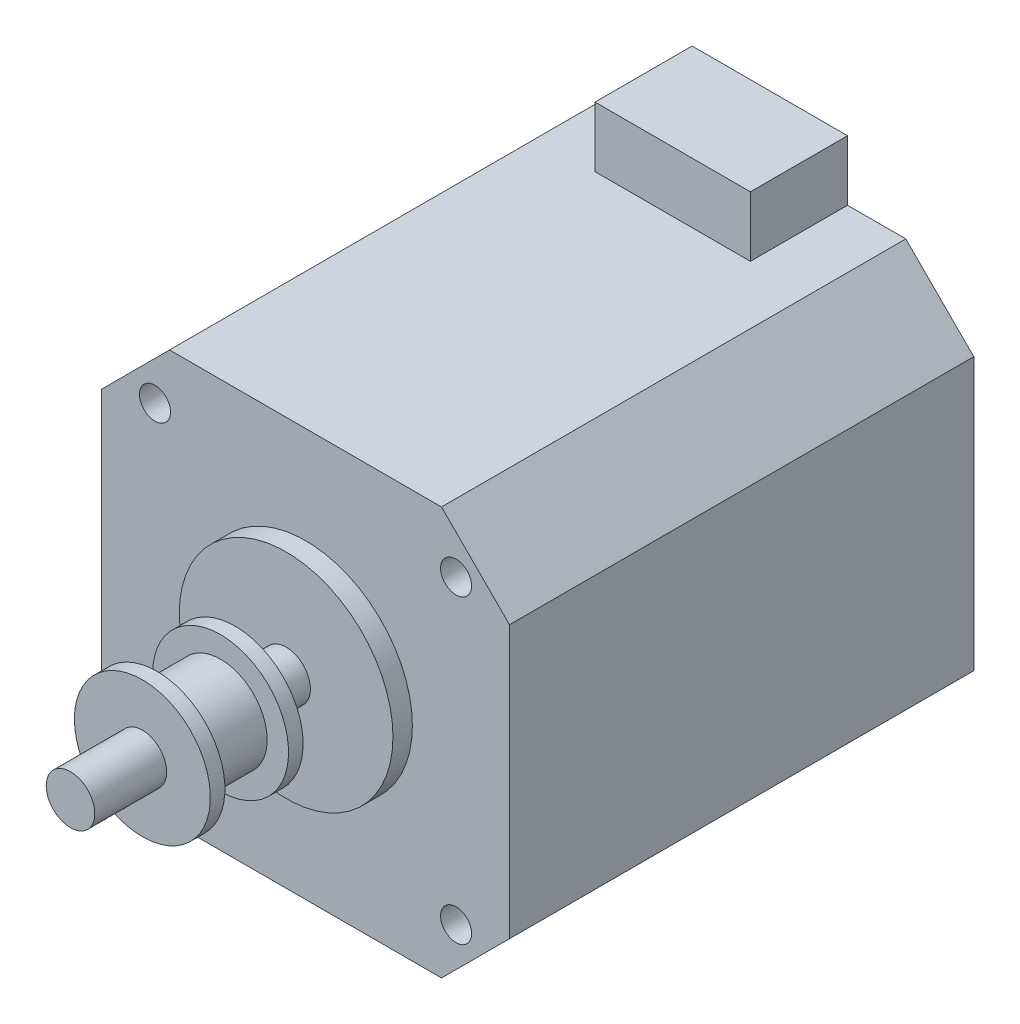
from build123d import *

# Parameters (mm, degrees)
SKETCH1_W           = 42
SKETCH1_H           = 42
BOSS_EXTRUDE1_DEPTH = 47.8
CHAMFER1_SIZE       = 7
SKETCH2_W           = 16
SKETCH2_H           = 6.2
BOSS_EXTRUDE2_DEPTH = 10
SKETCH3_R           = 11
BOSS_EXTRUDE3_DEPTH = 2
SKETCH4_R           = 1.6
CUT_EXTRUDE1_DEPTH  = 3


with BuildPart() as part:
    # Sketch1 → Boss-Extrude1 (new body)
    with BuildSketch(Plane.XY):
        with Locations((21, 21)):
            Rectangle(SKETCH1_W, SKETCH1_H)
    extrude(amount=BOSS_EXTRUDE1_DEPTH)

    # Chamfer1
    chamfer1_edges = [part.edges().sort_by_distance(p)[0] for p in [
        (0, 42, 23.9),
        (42, 42, 23.9),
        (42, 0, 23.9),
        (0, 0, 23.9),
    ]]
    chamfer(chamfer1_edges, length=CHAMFER1_SIZE)

    # Sketch2 → Boss-Extrude2 (add)
    with BuildSketch(Plane(origin=(0, 0, 0), x_dir=(-1, 0, 0), z_dir=(0, 0, -1))):
        with Locations((-21, 45.1)):
            Rectangle(SKETCH2_W, SKETCH2_H)
    extrude(amount=-BOSS_EXTRUDE2_DEPTH)

    # Sketch3 → Boss-Extrude3 (add)
    with BuildSketch(Plane.XY.offset(47.8)):
        with Locations((21, 21)):
            Circle(SKETCH3_R)
    extrude(amount=BOSS_EXTRUDE3_DEPTH)

    # Sketch4 → Cut-Extrude1 (cut)
    with BuildSketch(Plane.XY.offset(47.8)):
        with Locations((5.5, 36.5)):
            Circle(SKETCH4_R)
        with Locations((36.5, 36.5)):
            Circle(SKETCH4_R)
        with Locations((36.5, 5.5)):
            Circle(SKETCH4_R)
        with Locations((5.5, 5.5)):
            Circle(SKETCH4_R)
    extrude(amount=-CUT_EXTRUDE1_DEPTH, mode=Mode.SUBTRACT)

    # Sketch5 → Revolve1 (revolve)
    with BuildSketch(Plane(origin=(0, 21, 0), x_dir=(1, 0, 0), z_dir=(0, 1, 0)), mode=Mode.PRIVATE) as revolve1_sk:
        Polygon((23.5, -49.8), (21, -49.8), (21, -72), (23.5, -72), (23.5, -64.6), (28, -64.6), (28, -63.1), (25.8, -63.1), (25.8, -56.55), (28, -56.55), (28, -55.05), (23.5, -55.05), align=None)
    revolve(revolve1_sk.sketch.rotate(Axis((21, 21, 49.8), (0, 0, 1)), 180), axis=Axis((21, 21, 49.8), (0, 0, 1)))


solid = part.part
